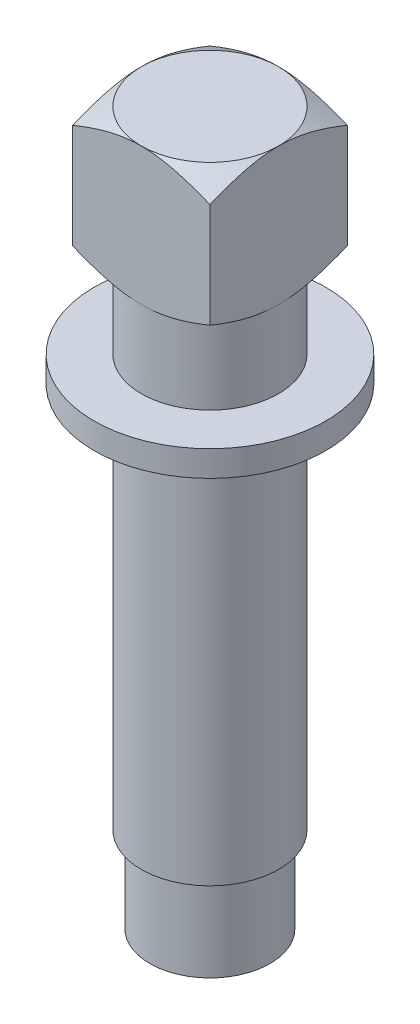
from build123d import *

# Parameters (mm, degrees)
SKETCH2_W           = 16
SKETCH2_H           = 16
BOSS_EXTRUDE1_DEPTH = 16
SKETCH3_OUTSIDE_W   = 81.914
SKETCH3_OUTSIDE_H   = 81.914
SKETCH3_OUTSIDE_R   = 8
CUT_EXTRUDE1_DEPTH  = 10
CUT_EXTRUDE1_DRAFT  = -60
SKETCH4_OUTSIDE_W   = 81.914
SKETCH4_OUTSIDE_H   = 81.914
SKETCH4_OUTSIDE_R   = 8
CUT_EXTRUDE2_DEPTH  = 10
CUT_EXTRUDE2_DRAFT  = -60


with BuildPart() as part:
    # Sketch1 → Revolve1 (revolve)
    with BuildSketch(Plane.XY):
        Polygon((0, 0), (-7, 0), (-7, 10), (-8, 10), (-8, 55), (-13.5, 55), (-13.5, 58), (-8, 58), (-8, 67), (0, 67), align=None)
    revolve(axis=Axis((0, 67, 0), (0, -1, 0)))

    # Sketch2 → Boss-Extrude1 (add)
    with BuildSketch(Plane(origin=(0, 67, 0), x_dir=(1, 0, 0), z_dir=(0, 1, 0))):
        Rectangle(SKETCH2_W, SKETCH2_H)
    extrude(amount=BOSS_EXTRUDE1_DEPTH)


with BuildPart() as cut_extrude1_tool:
    # Sketch3 outside → Cut-Extrude1 (with draft: the straight prism first)
    with BuildSketch(Plane(origin=(0, 83, 0), x_dir=(1, 0, 0), z_dir=(0, 1, 0))):
        Rectangle(SKETCH3_OUTSIDE_W, SKETCH3_OUTSIDE_H)
        with Locations(Location((0, 0, 0), (0, 0, 180))):
            Circle(SKETCH3_OUTSIDE_R, mode=Mode.SUBTRACT)
    extrude(amount=-CUT_EXTRUDE1_DEPTH)
    # Cut-Extrude1: the draft: its side faces are tilted about the plane it starts from
    cut_extrude1_sides = [cut_extrude1_tool.faces().sort_by_distance(p)[0] for p in [
        (0, 78, 40.957),
        (40.957, 78, 0),
        (0, 78, -40.957),
        (-40.957, 78, 0),
        (8, 78, 0),
    ]]
    draft(cut_extrude1_sides, Plane(origin=(0, 83, 0), x_dir=(1, 0, 0), z_dir=(0, 1, 0)), CUT_EXTRUDE1_DRAFT)


with BuildPart() as part_1:
    add(part.part)

    # Cut-Extrude1: cut by cut_extrude1_tool
    add(cut_extrude1_tool.part, mode=Mode.SUBTRACT)


with BuildPart() as cut_extrude2_tool:
    # Sketch4 outside → Cut-Extrude2 (with draft: the straight prism first)
    with BuildSketch(Plane.XZ.offset(-67)):
        Rectangle(SKETCH4_OUTSIDE_W, SKETCH4_OUTSIDE_H)
        with Locations(Location((0, 0, 0), (0, 0, 180))):
            Circle(SKETCH4_OUTSIDE_R, mode=Mode.SUBTRACT)
    extrude(amount=-CUT_EXTRUDE2_DEPTH)
    # Cut-Extrude2: the draft: its side faces are tilted about the plane it starts from
    cut_extrude2_sides = [cut_extrude2_tool.faces().sort_by_distance(p)[0] for p in [
        (0, 72, -40.957),
        (40.957, 72, 0),
        (0, 72, 40.957),
        (-40.957, 72, 0),
        (8, 72, 0),
    ]]
    draft(cut_extrude2_sides, Plane.XZ.offset(-67), CUT_EXTRUDE2_DRAFT)


with BuildPart() as part_2:
    add(part_1.part)

    # Cut-Extrude2: cut by cut_extrude2_tool
    add(cut_extrude2_tool.part, mode=Mode.SUBTRACT)


solid = part_2.part
